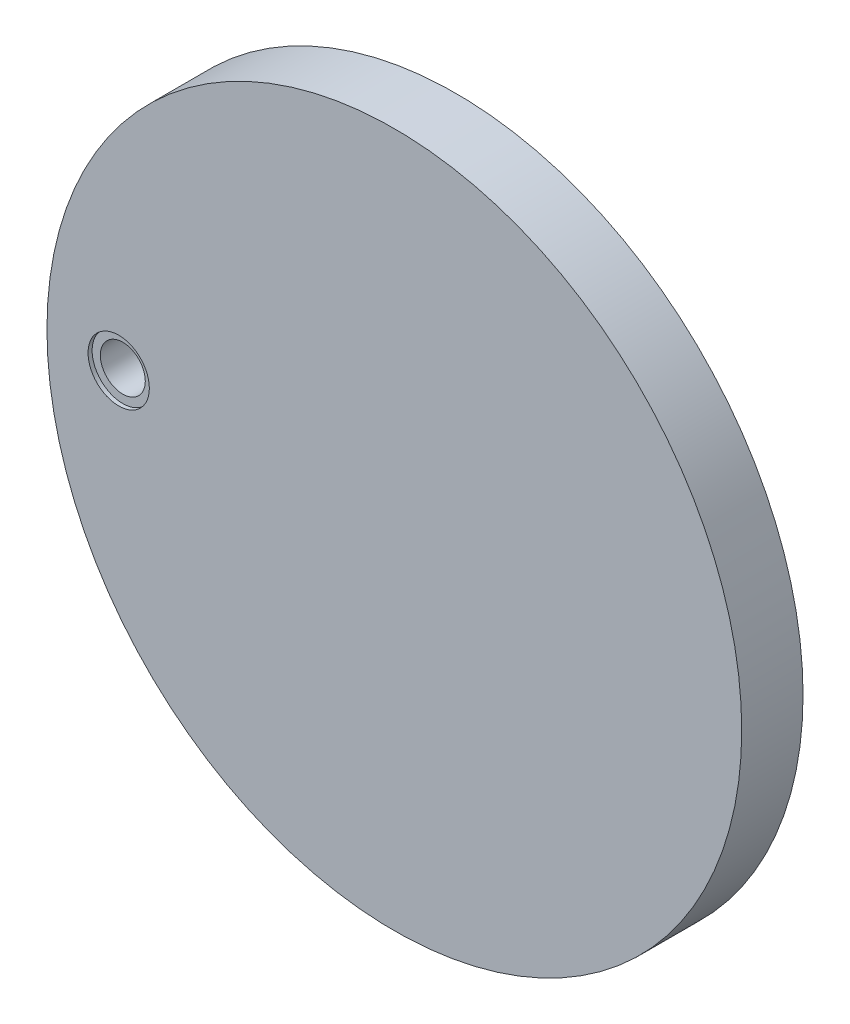
from build123d import *

# Parameters (mm, degrees)
ESQUISSE1_R             = 85
BOSS_EXTRU_1_DEPTH      = 15
ESQUISSE2_R             = 7.5
ENL_V_MAT_EXTRU_1_DEPTH = 1
ESQUISSE4_R             = 5.5
ENL_V_MAT_EXTRU_2_DEPTH = 15


with BuildPart() as part:
    # Esquisse1 → Boss.-Extru.1 (new body)
    with BuildSketch(Plane.XY):
        with Locations((-112.573673301, 0)):
            Circle(ESQUISSE1_R)
    extrude(amount=BOSS_EXTRU_1_DEPTH)

    # Esquisse2 → Enlèv. mat.-Extru.1 (cut)
    with BuildSketch(Plane.XY.offset(15)):
        with Locations((-180.019561977, 0)):
            Circle(ESQUISSE2_R)
    extrude(amount=-ENL_V_MAT_EXTRU_1_DEPTH, mode=Mode.SUBTRACT)

    # Esquisse4 → Enlèv. mat.-Extru.2 (cut)
    with BuildSketch(Plane.XY.offset(14)):
        with Locations((-180.010590856, 0)):
            Circle(ESQUISSE4_R)
    extrude(amount=-ENL_V_MAT_EXTRU_2_DEPTH, mode=Mode.SUBTRACT)


solid = part.part
